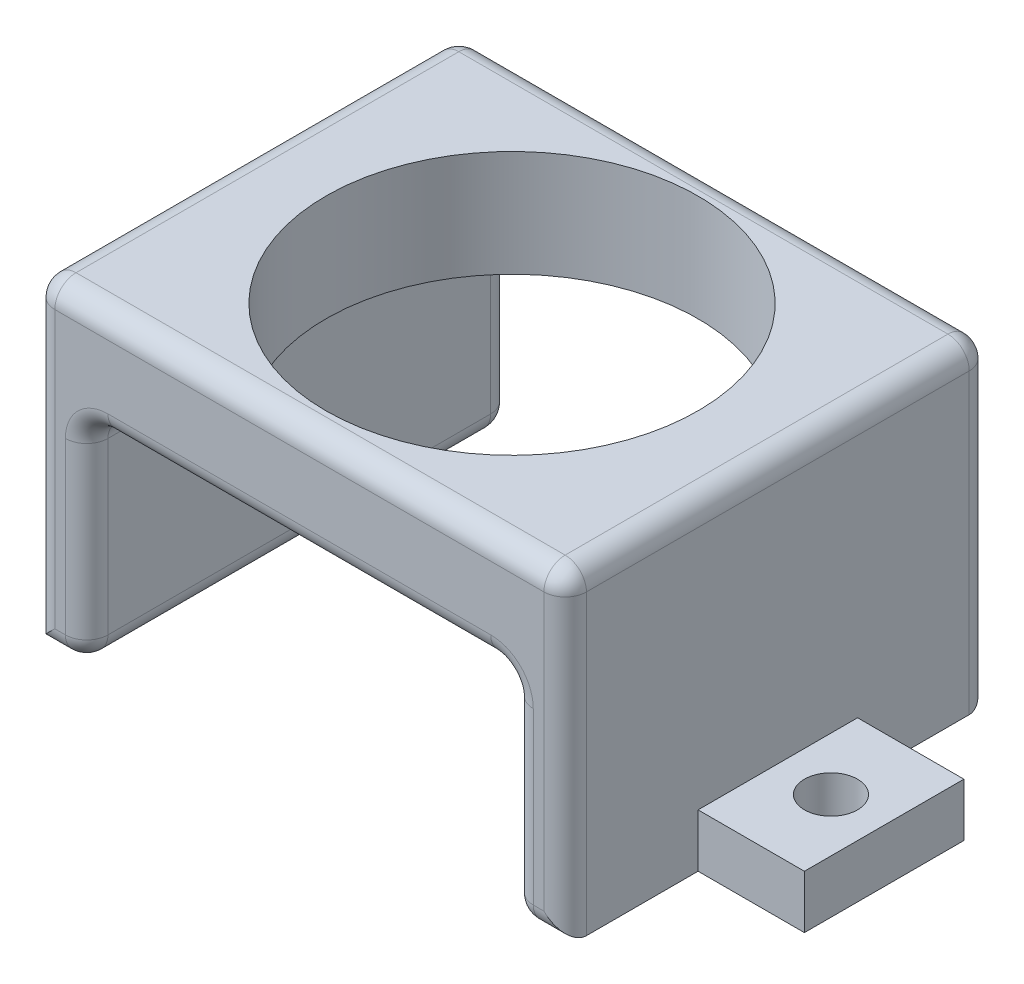
from build123d import *

# Parameters (mm, degrees)
SKETCH1_W             = 5
SKETCH1_H             = 40
BOSS_EXTRUDE1_DEPTH   = 20
BOSS_EXTRUDE1_2_DEPTH = 20
SKETCH2_W             = 50
SKETCH2_H             = 40
SKETCH2_R             = 17.5
BOSS_EXTRUDE2_DEPTH   = 10
SKETCH3_W             = 15
SKETCH3_H             = 15
SKETCH3_R             = 2.5
BOSS_EXTRUDE3_DEPTH   = 5
FILLET1_R             = 2


with BuildPart() as part:
    # Sketch1 → Boss-Extrude1 (new body)
    with BuildSketch(Plane(origin=(0, 0, 0), x_dir=(1, 0, 0), z_dir=(0, 1, 0))):
        with Locations((-42.5, 20)):
            Rectangle(SKETCH1_W, SKETCH1_H)
    extrude(amount=BOSS_EXTRUDE1_DEPTH)



with BuildPart() as body_2:
    # Sketch1 → Boss-Extrude1 2 (new body)
    with BuildSketch(Plane(origin=(0, 0, 0), x_dir=(1, 0, 0), z_dir=(0, 1, 0))):
        with Locations((2.5, 20)):
            Rectangle(SKETCH1_W, SKETCH1_H)
    extrude(amount=BOSS_EXTRUDE1_2_DEPTH)


with BuildPart() as part_1:
    add(part.part)

    add(body_2.part)  # Boss-Extrude2 merges body 2
    # Sketch2 → Boss-Extrude2 (add)
    with BuildSketch(Plane(origin=(0, 20, 0), x_dir=(1, 0, 0), z_dir=(0, 1, 0))):
        with Locations((-20, 20)):
            Rectangle(SKETCH2_W, SKETCH2_H)
        with Locations(Location((-20, 20, 0), (0, 0, 270))):
            Circle(SKETCH2_R, mode=Mode.SUBTRACT)
    extrude(amount=BOSS_EXTRUDE2_DEPTH)

    # Sketch3 → Boss-Extrude3 (add)
    # profile 1 of 2: a face of its own
    with BuildSketch(Plane.XZ):
        with Locations((-47.5, -20)):
            Rectangle(SKETCH3_W, SKETCH3_H)
        with Locations(Location((-50, -20, 0), (0, 0, 270))):
            Circle(SKETCH3_R, mode=Mode.SUBTRACT)
    # profile 2 of 2: a face of its own
    with BuildSketch(Plane.XZ):
        with Locations((7.5, -20)):
            Rectangle(SKETCH3_W, SKETCH3_H)
        with Locations(Location((10, -20, 0), (0, 0, 270))):
            Circle(SKETCH3_R, mode=Mode.SUBTRACT)
    extrude(amount=-BOSS_EXTRUDE3_DEPTH)

    # Fillet1
    fillet1_edges = [part_1.edges().sort_by_distance(p)[0] for p in [
        (-40, 20, -20),
        (-45, 30, -20),
        (-20, 30, 0),
        (5, 30, -20),
        (-20, 30, -40),
        (-20, 20, 0),
        (5, 15, 0),
        (5, 15, -40),
        (-20, 20, -40),
        (0, 0, -20),
        (0, 10, -40),
        (2.5, 0, 0),
        (0, 10, 0),
        (2.5, 0, -40),
        (0, 20, -20),
        (-42.5, 0, -40),
        (-40, 0, -20),
        (-42.5, 0, 0),
        (-45, 15, -40),
        (-40, 10, -40),
        (-40, 10, 0),
        (-45, 15, 0),
    ]]
    fillet(fillet1_edges, radius=FILLET1_R)


solid = part_1.part
